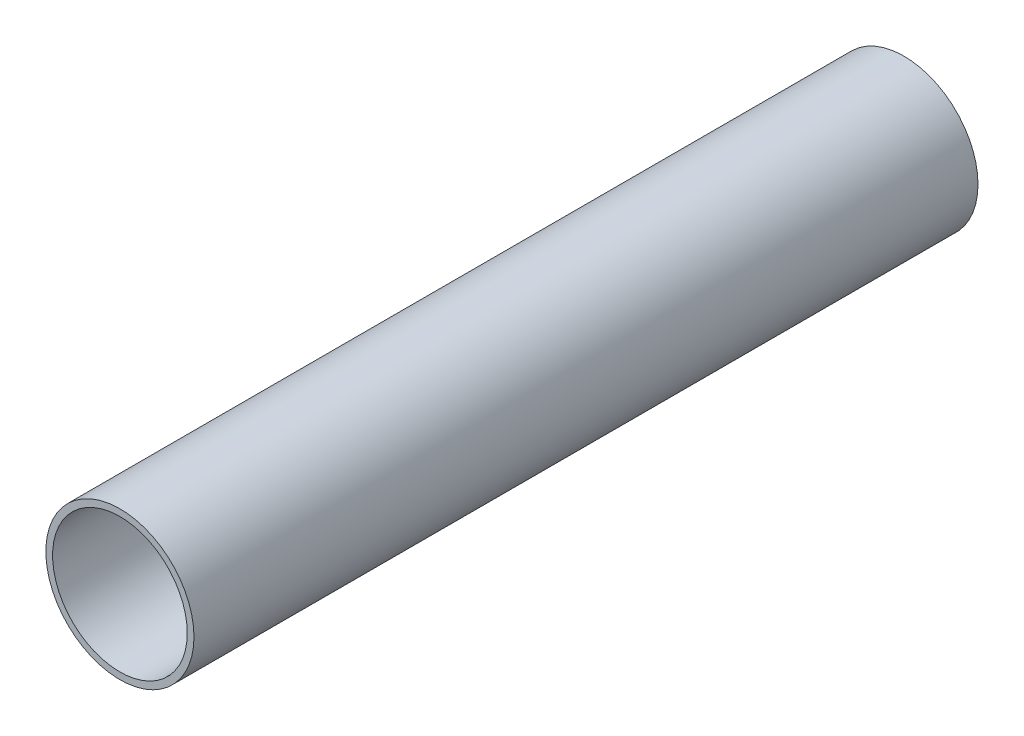
from build123d import *

# Parameters (mm, degrees)
SKETCH16_R          = 13.97
SKETCH16_R_2        = 12.7
BOSS_EXTRUDE1_DEPTH = 73.95


with BuildPart() as part:
    # Sketch16 → Boss-Extrude1 (new, symmetric)
    with BuildSketch(Plane.XY):
        Circle(SKETCH16_R)
        Circle(SKETCH16_R_2, mode=Mode.SUBTRACT)
    extrude(amount=BOSS_EXTRUDE1_DEPTH, both=True)


solid = part.part
